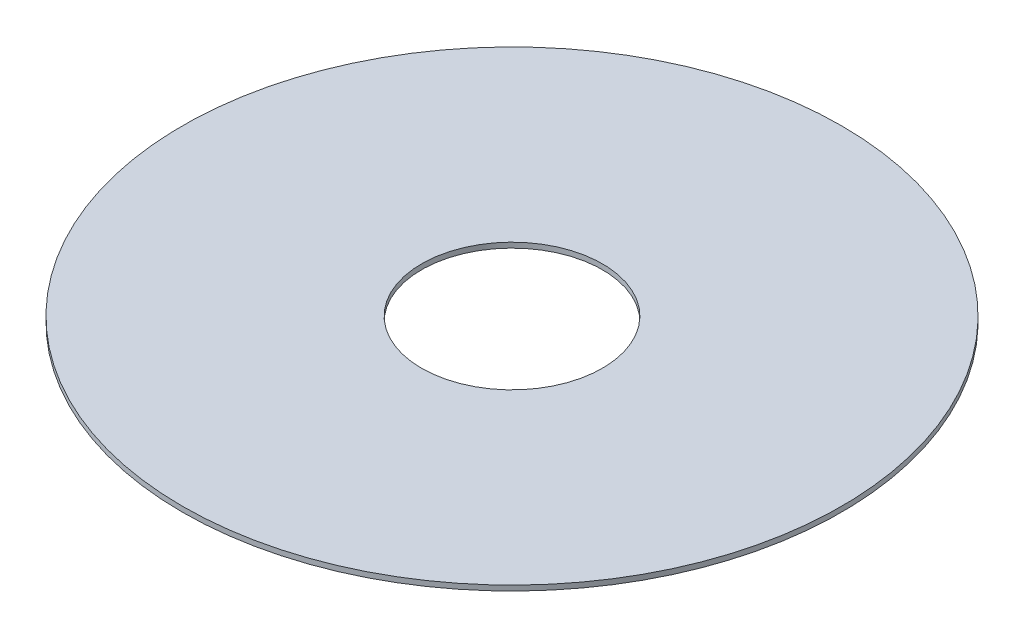
from build123d import *

# Parameters (mm, degrees)
AUFSATZ_LINEAR_AUSTRAGEN1_DEPTH      = 0.1
AUFSATZ_LINEAR_AUSTRAGEN1_DEPTH_BACK = 0.1
SKIZZE1_R                            = 12.75
SKIZZE1_R_2                          = 3.5


with BuildPart() as part:
    # Skizze1 → Aufsatz-Linear austragen1 (new, two sides: drawn at the far end of the back side and taken through both)
    with BuildSketch(Plane(origin=(0, 0, 0), x_dir=(1, 0, 0), z_dir=(0, 1, 0)).offset(-AUFSATZ_LINEAR_AUSTRAGEN1_DEPTH_BACK)):
        Circle(SKIZZE1_R)
        Circle(SKIZZE1_R_2, mode=Mode.SUBTRACT)
    extrude(amount=AUFSATZ_LINEAR_AUSTRAGEN1_DEPTH + AUFSATZ_LINEAR_AUSTRAGEN1_DEPTH_BACK)


solid = part.part
